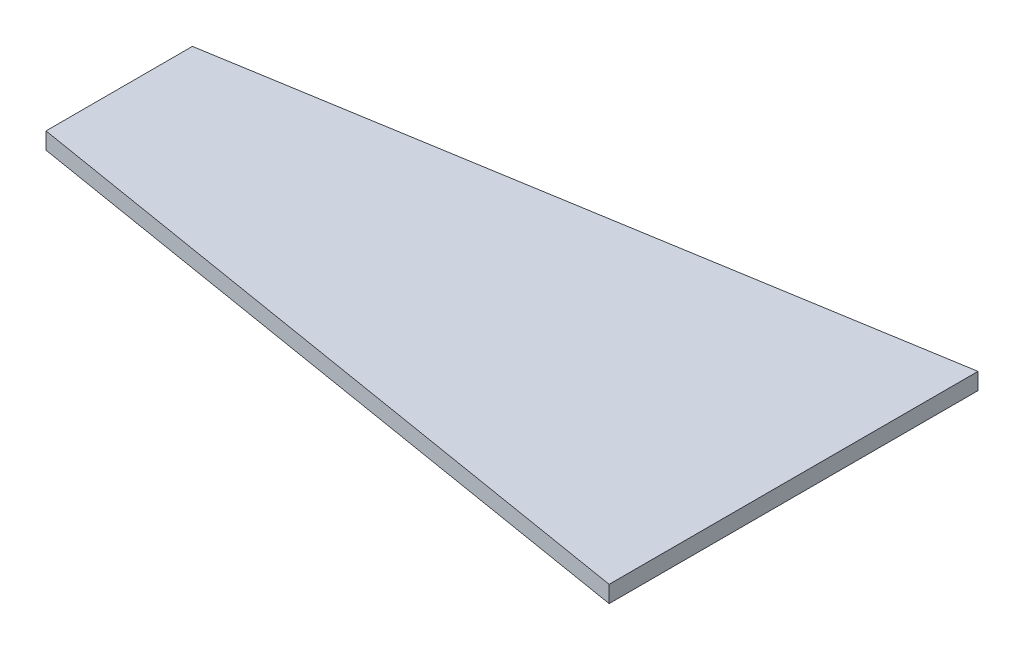
from build123d import *

# Parameters (mm, degrees)
SKETCH1_W           = 263.3434916
SKETCH1_H           = 204.19140391
BOSS_EXTRUDE1_DEPTH = 4.599999944
SKETCH2_OUTSIDE_W   = 331.995
SKETCH2_OUTSIDE_H   = 272.843
CUT_EXTRUDE1_DEPTH  = 334.264285513


with BuildPart() as part:
    # Sketch1 → Boss-Extrude1 (new body)
    with BuildSketch(Plane(origin=(0, 0, 0), x_dir=(1, 0, 0), z_dir=(0, 1, 0))):
        with Locations((131.6717458, 102.095701955)):
            Rectangle(SKETCH1_W, SKETCH1_H)
    extrude(amount=BOSS_EXTRUDE1_DEPTH)

    # Sketch2 outside → Cut-Extrude1 (cut, through all)
    with BuildSketch(Plane.XZ):
        with Locations((131.6715, -102.0955)):
            Rectangle(SKETCH2_OUTSIDE_W, SKETCH2_OUTSIDE_H)
        Polygon((263.3434916, -123.3914039), (263.3434916, -21.850396731), (77.744363276, -52.441403941), (77.744363276, -92.741403859), align=None, mode=Mode.SUBTRACT)
    extrude(amount=-CUT_EXTRUDE1_DEPTH, mode=Mode.SUBTRACT)


solid = part.part
